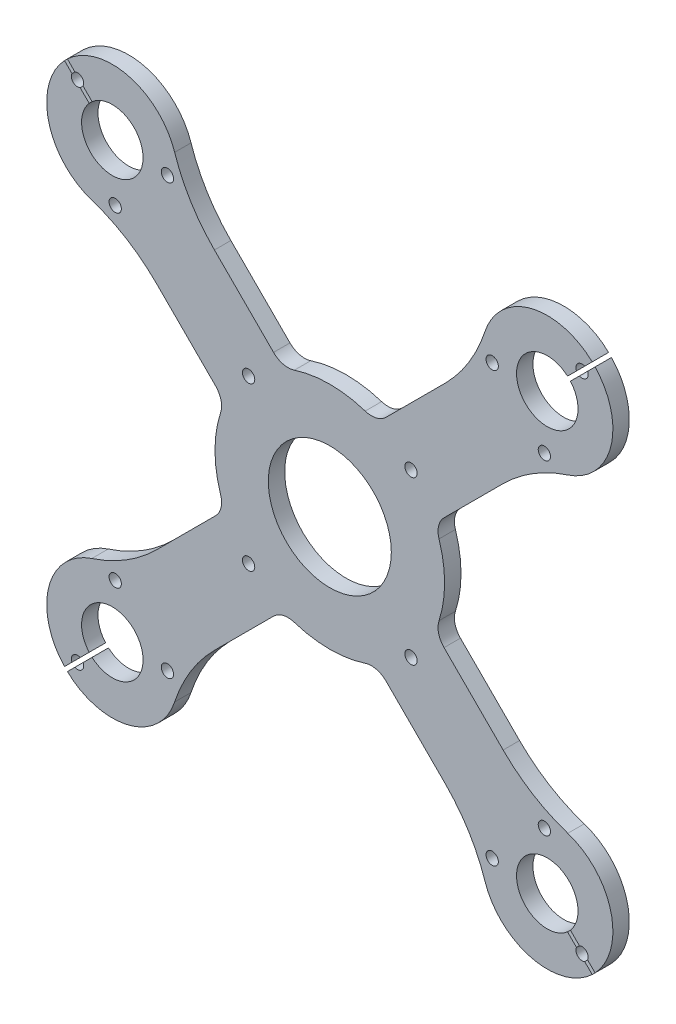
from build123d import *

# Parameters (mm, degrees)
SKETCH1_R           = 1.5
SKETCH1_R_2         = 7.5
SKETCH1_R_3         = 15
BOSS_EXTRUDE1_DEPTH = 4
CUT_EXTRUDE2_DEPTH  = 98.709326831
FILLET3_R           = 40
FILLET4_R           = 5


with BuildPart() as part:
    # Sketch1 → Boss-Extrude1 (new body)
    with BuildSketch(Plane.XY):
        with BuildLine():
            Line((37.130179911, 51.272315535), (11.422174197, 25.564309821))
            ThreePointArc((11.422174197, 25.564309821), (0, 28), (-11.422174197, 25.564309821))
            Line((-11.422174197, 25.564309821), (-37.130179911, 51.272315535))
            ThreePointArc((-37.130179911, 51.272315535), (-64.346717088, 64.346717088), (-51.272315535, 37.130179911))
            Line((-51.272315535, 37.130179911), (-25.564309821, 11.422174197))
            ThreePointArc((-25.564309821, 11.422174197), (-28, 0), (-25.564309821, -11.422174197))
            Line((-25.564309821, -11.422174197), (-51.272315535, -37.130179911))
            ThreePointArc((-51.272315535, -37.130179911), (-64.346717088, -64.346717088), (-37.130179911, -51.272315535))
            Line((-37.130179911, -51.272315535), (-11.422174197, -25.564309821))
            ThreePointArc((-11.422174197, -25.564309821), (0, -28), (11.422174197, -25.564309821))
            Line((11.422174197, -25.564309821), (37.130179911, -51.272315535))
            ThreePointArc((37.130179911, -51.272315535), (64.346717088, -64.346717088), (51.272315535, -37.130179911))
            Line((51.272315535, -37.130179911), (25.564309821, -11.422174197))
            ThreePointArc((25.564309821, -11.422174197), (28, 0), (25.564309821, 11.422174197))
            Line((25.564309821, 11.422174197), (51.272315535, 37.130179911))
            ThreePointArc((51.272315535, 37.130179911), (64.346717088, 64.346717088), (37.130179911, 51.272315535))
        make_face()
        with Locations((52.325901808, 39.597979746)):
            Circle(SKETCH1_R, mode=Mode.SUBTRACT)
        with Locations((19.798989873, -19.798989873)):
            Circle(SKETCH1_R, mode=Mode.SUBTRACT)
        with Locations((61.518289963, 61.518289963)):
            Circle(SKETCH1_R, mode=Mode.SUBTRACT)
        with Locations((-19.798989873, -19.798989873)):
            Circle(SKETCH1_R, mode=Mode.SUBTRACT)
        with Locations((19.798989873, 19.798989873)):
            Circle(SKETCH1_R, mode=Mode.SUBTRACT)
        with Locations((-19.798989873, 19.798989873)):
            Circle(SKETCH1_R, mode=Mode.SUBTRACT)
        with Locations((39.597979746, 52.325901808)):
            Circle(SKETCH1_R, mode=Mode.SUBTRACT)
        with Locations((53.033008589, 53.033008589)):
            Circle(SKETCH1_R_2, mode=Mode.SUBTRACT)
        with Locations((53.033008589, -53.033008589)):
            Circle(SKETCH1_R_2, mode=Mode.SUBTRACT)
        with Locations((61.518289963, -61.518289963)):
            Circle(SKETCH1_R, mode=Mode.SUBTRACT)
        with Locations((52.325901808, -39.597979746)):
            Circle(SKETCH1_R, mode=Mode.SUBTRACT)
        with Locations((39.597979746, -52.325901808)):
            Circle(SKETCH1_R, mode=Mode.SUBTRACT)
        with Locations((-53.033008589, -53.033008589)):
            Circle(SKETCH1_R_2, mode=Mode.SUBTRACT)
        with Locations((-61.518289963, -61.518289963)):
            Circle(SKETCH1_R, mode=Mode.SUBTRACT)
        with Locations((-39.597979746, -52.325901808)):
            Circle(SKETCH1_R, mode=Mode.SUBTRACT)
        with Locations((-52.325901808, -39.597979746)):
            Circle(SKETCH1_R, mode=Mode.SUBTRACT)
        with Locations((-53.033008589, 53.033008589)):
            Circle(SKETCH1_R_2, mode=Mode.SUBTRACT)
        with Locations((-61.518289963, 61.518289963)):
            Circle(SKETCH1_R, mode=Mode.SUBTRACT)
        with Locations((-52.325901808, 39.597979746)):
            Circle(SKETCH1_R, mode=Mode.SUBTRACT)
        with Locations((-39.597979746, 52.325901808)):
            Circle(SKETCH1_R, mode=Mode.SUBTRACT)
        Circle(SKETCH1_R_3, mode=Mode.SUBTRACT)
    extrude(amount=BOSS_EXTRUDE1_DEPTH)

    # Sketch3 → Cut-Extrude2 (cut, through all)
    with BuildSketch(Plane.XY.offset(4)):
        Polygon((63.993163697, 64.700270479), (57.970957821, 58.678064602), (58.678064602, 57.970957821), (64.700270479, 63.993163697), align=None)
        Polygon((58.678064602, -57.970957821), (57.970957821, -58.678064602), (63.993163697, -64.700270479), (64.700270479, -63.993163697), align=None)
        Polygon((-57.970957821, -58.678064602), (-58.678064602, -57.970957821), (-64.700270479, -63.993163697), (-63.993163697, -64.700270479), align=None)
        Polygon((-58.678064602, 57.970957821), (-57.970957821, 58.678064602), (-63.993163697, 64.700270479), (-64.700270479, 63.993163697), align=None)
    extrude(amount=-CUT_EXTRUDE2_DEPTH, mode=Mode.SUBTRACT)

    # Fillet3
    fillet3_edges = [part.edges().sort_by_distance(p)[0] for p in [
        (37.130179911, 51.272315535, 2),
        (51.272315535, 37.130179911, 2),
        (51.272315535, -37.130179911, 2),
        (37.130179911, -51.272315535, 2),
        (-37.130179911, -51.272315535, 2),
        (-51.272315535, -37.130179911, 2),
        (-51.272315535, 37.130179911, 2),
        (-37.130179911, 51.272315535, 2),
    ]]
    fillet(fillet3_edges, radius=FILLET3_R)

    # Fillet4
    fillet4_edges = [part.edges().sort_by_distance(p)[0] for p in [
        (11.422174197, 25.564309821, 2),
        (25.564309821, 11.422174197, 2),
        (25.564309821, -11.422174197, 2),
        (11.422174197, -25.564309821, 2),
        (-11.422174197, -25.564309821, 2),
        (-25.564309821, -11.422174197, 2),
        (-25.564309821, 11.422174197, 2),
        (-11.422174197, 25.564309821, 2),
    ]]
    fillet(fillet4_edges, radius=FILLET4_R)


solid = part.part
